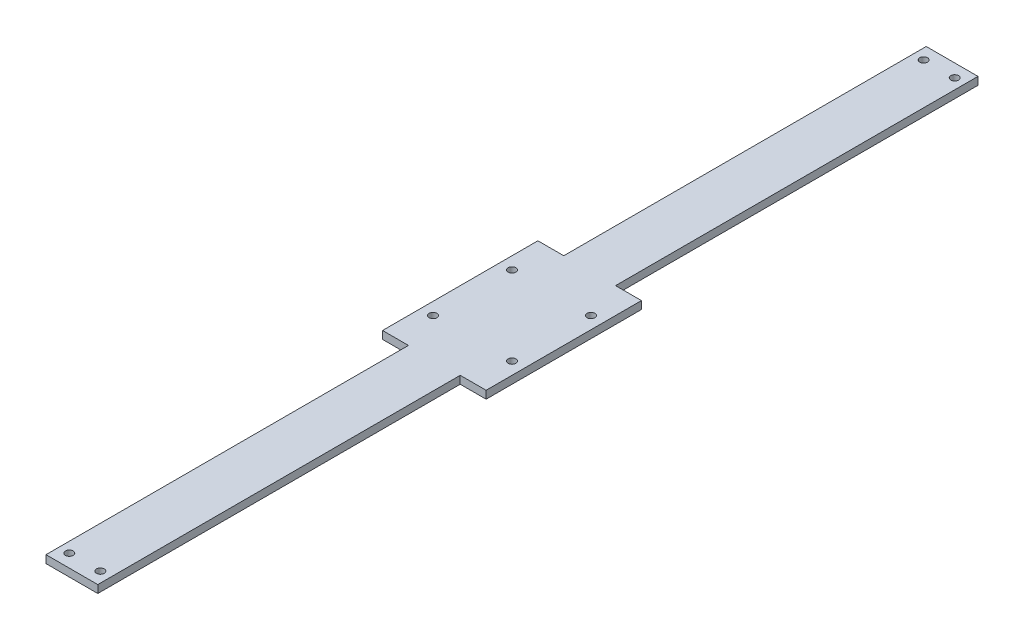
from build123d import *

# Parameters (mm, degrees)
SKETCH1_R            = 1.5
BOSS_EXTRUDE1_DEPTH  = 1.5
SKETCH2_R            = 1.5
CONNECTOR0HOLE_DEPTH = 172.17899988
CIRPATTERN1_COUNT    = 2


with BuildPart() as part:
    # Sketch1 → Boss-Extrude1 (new, symmetric)
    with BuildSketch(Plane(origin=(0, 0, 0), x_dir=(1, 0, 0), z_dir=(0, 1, 0))):
        Polygon((-10, 170), (-10, 30), (-20, 30), (-20, -30), (-10, -30), (-10, -170), (10, -170), (10, -30), (20, -30), (20, 30), (10, 30), (10, 170), align=None)
        with Locations((-15.25, 15.25)):
            Circle(SKETCH1_R, mode=Mode.SUBTRACT)
        with Locations((15.25, 15.25)):
            Circle(SKETCH1_R, mode=Mode.SUBTRACT)
        with Locations((15.25, -15.25)):
            Circle(SKETCH1_R, mode=Mode.SUBTRACT)
        with Locations((-15.25, -15.25)):
            Circle(SKETCH1_R, mode=Mode.SUBTRACT)
    extrude(amount=BOSS_EXTRUDE1_DEPTH, both=True)

    # Sketch2 → connector0hole (cut, symmetric)
    with BuildSketch(Plane(origin=(0, 0, 0), x_dir=(1, 0, 0), z_dir=(0, 1, 0))):
        with Locations((-6, 165)):
            Circle(SKETCH2_R)
        with Locations((6, 165)):
            Circle(SKETCH2_R)
    connector0hole = extrude(amount=CONNECTOR0HOLE_DEPTH, both=True, mode=Mode.SUBTRACT)

    # CirPattern1: connector0hole ×2 about axis
    cirpattern1_axis = Axis((0, 177.495542011, 0), (0, -1, 0))
    for i in range(1, CIRPATTERN1_COUNT):
        add(connector0hole.rotate(cirpattern1_axis, i * 360 / CIRPATTERN1_COUNT), mode=Mode.SUBTRACT)


solid = part.part
